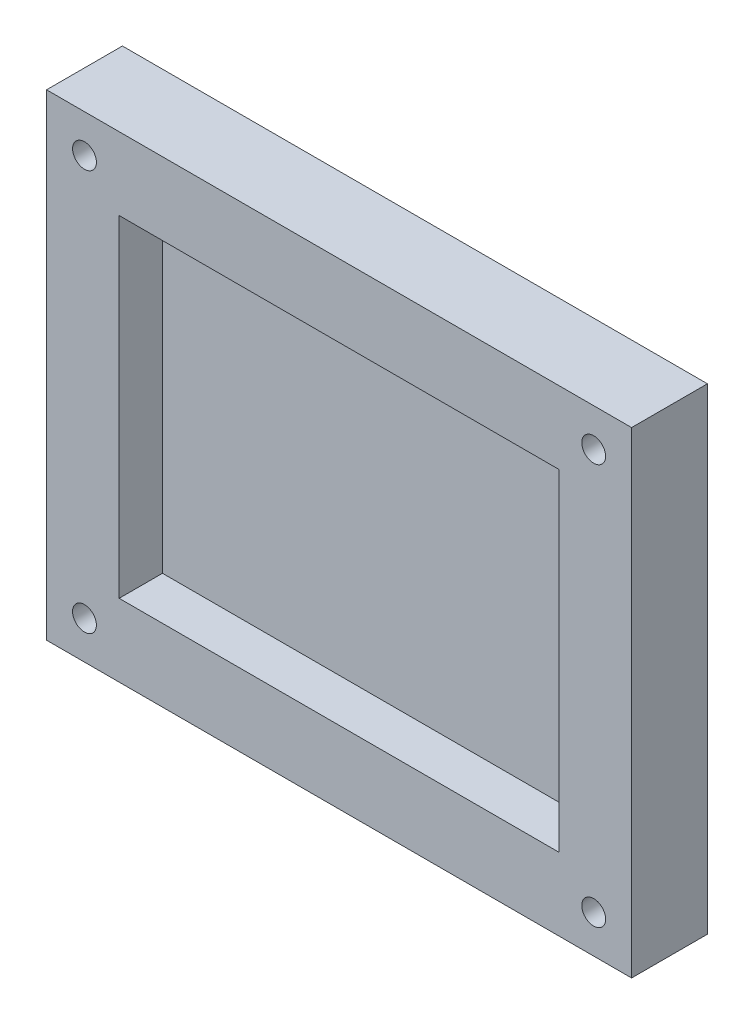
from build123d import *

# Parameters (mm, degrees)
SKETCH2_W                   = 108
SKETCH2_H                   = 88
FIXTURE_FLOOR_DEPTH         = 6
ENCLOSURE_NEST_START        = 6
SKETCH3_W                   = 108
SKETCH3_H                   = 88
SKETCH3_W_2                 = 81.2
SKETCH3_H_2                 = 61.2
ENCLOSURE_NEST_DEPTH        = 8
SKETCH4_R                   = 2.2
BENCH_MOUNT_CLEARANCE_DEPTH = 14
SKETCH5_R                   = 2.2
CUT_EXTRUDE2_DEPTH          = 14
SKETCH6_R                   = 2.2
CUT_EXTRUDE3_DEPTH          = 14
SKETCH7_R                   = 2.2
CUT_EXTRUDE4_DEPTH          = 14


with BuildPart() as part:
    # Sketch2 → Fixture_floor (new body)
    with BuildSketch(Plane.XY):
        Rectangle(SKETCH2_W, SKETCH2_H)
    extrude(amount=FIXTURE_FLOOR_DEPTH)

    # Sketch3 → Enclosure_nest (add)
    with BuildSketch(Plane.XY.offset(ENCLOSURE_NEST_START)):
        Rectangle(SKETCH3_W, SKETCH3_H)
        Rectangle(SKETCH3_W_2, SKETCH3_H_2, mode=Mode.SUBTRACT)
    extrude(amount=ENCLOSURE_NEST_DEPTH)

    # Sketch4 → Bench_mount_clearance (cut)
    with BuildSketch(Plane.XY):
        with Locations((-47, -37)):
            Circle(SKETCH4_R)
    extrude(amount=BENCH_MOUNT_CLEARANCE_DEPTH, mode=Mode.SUBTRACT)

    # Sketch5 → Cut-Extrude2 (cut)
    with BuildSketch(Plane.XY):
        with Locations((-47, 37)):
            Circle(SKETCH5_R)
    extrude(amount=CUT_EXTRUDE2_DEPTH, mode=Mode.SUBTRACT)

    # Sketch6 → Cut-Extrude3 (cut)
    with BuildSketch(Plane.XY):
        with Locations((47, -37)):
            Circle(SKETCH6_R)
    extrude(amount=CUT_EXTRUDE3_DEPTH, mode=Mode.SUBTRACT)

    # Sketch7 → Cut-Extrude4 (cut)
    with BuildSketch(Plane.XY):
        with Locations((47, 37)):
            Circle(SKETCH7_R)
    extrude(amount=CUT_EXTRUDE4_DEPTH, mode=Mode.SUBTRACT)


solid = part.part
